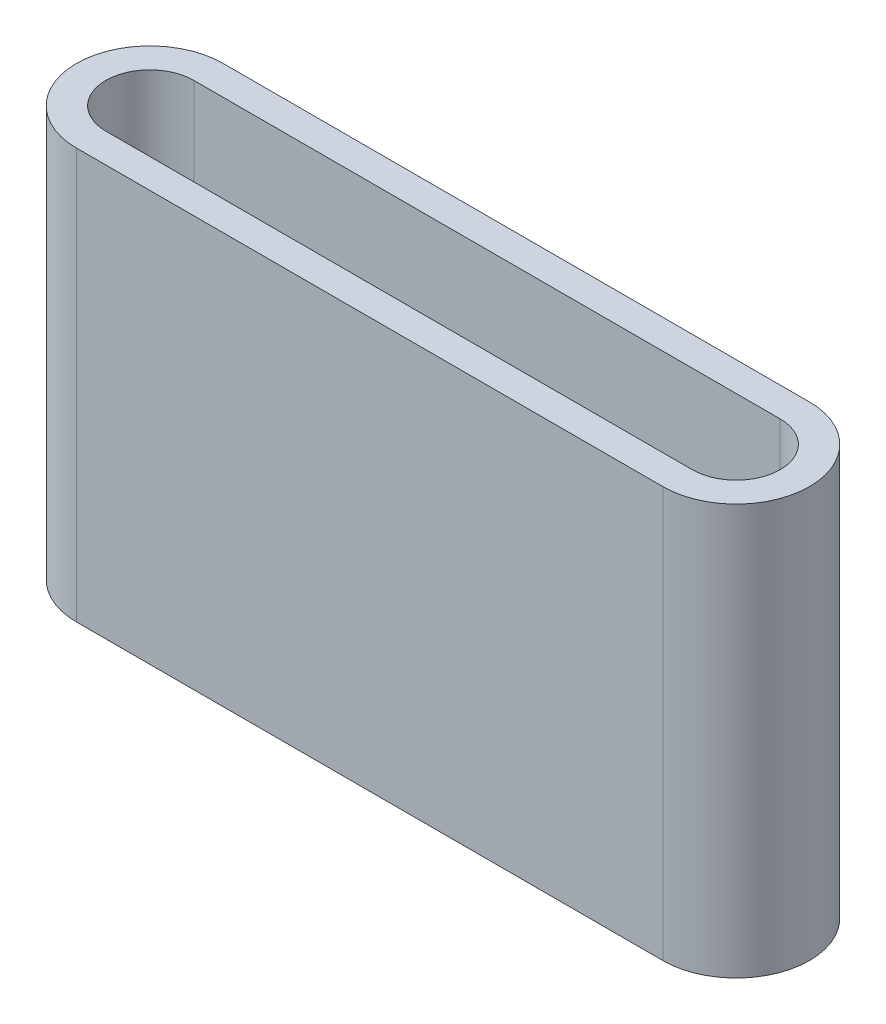
from build123d import *

# Parameters (mm, degrees)
EXTRUDE_1_DEPTH      = 20
EXTRUDE_1_DEPTH_BACK = 10
EXTRUDE_1_2_DEPTH    = 40


with BuildPart() as part:
    # 草图1 → Extrude 1 (new, two sides: drawn at the far end of the back side and taken through both)
    with BuildSketch(Plane(origin=(0, 0, 0), x_dir=(1, 0, 0), z_dir=(0, 1, 0)).offset(-EXTRUDE_1_DEPTH_BACK)):
        with BuildLine():
            Line((0, 12.5), (100, 12.5))
            ThreePointArc((100, 12.5), (112.5, 0), (100, -12.5))
            Line((100, -12.5), (0, -12.5))
            ThreePointArc((0, -12.5), (-12.5, 0), (0, 12.5))
        make_face()
    extrude(amount=EXTRUDE_1_DEPTH + EXTRUDE_1_DEPTH_BACK)

    # 草图2 → Extrude 1 2 (add)
    with BuildSketch(Plane(origin=(0, 20, 0), x_dir=(1, 0, 0), z_dir=(0, 1, 0))):
        with BuildLine():
            Line((100, 12.5), (0, 12.5))
            ThreePointArc((0, 12.5), (-12.5, 0), (0, -12.5))
            Line((0, -12.5), (100, -12.5))
            ThreePointArc((100, -12.5), (112.5, 0), (100, 12.5))
        make_face()
        with BuildLine():
            Line((100, 7.5), (0, 7.5))
            ThreePointArc((0, 7.5), (-7.5, 0), (0, -7.5))
            Line((0, -7.5), (100, -7.5))
            ThreePointArc((100, -7.5), (107.5, 0), (100, 7.5))
        make_face(mode=Mode.SUBTRACT)
    extrude(amount=EXTRUDE_1_2_DEPTH)


solid = part.part
